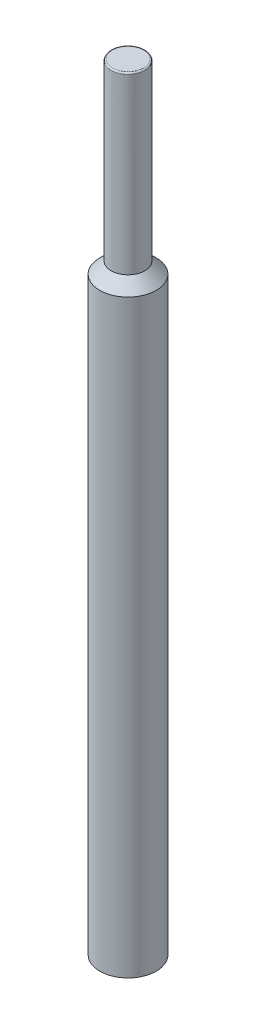
from build123d import *

# Parameters (mm, degrees)
FILLET1_R = 0.5


with BuildPart() as part:
    # Sketch2 → Revolve1 (revolve)
    with BuildSketch(Plane.XY, mode=Mode.PRIVATE) as revolve1_sk:
        Polygon((0, 0), (10, 0), (10, 209), (6, 213), (6, 275), (0, 275), align=None)
    revolve(revolve1_sk.sketch.rotate(Axis((0, 0, 0), (0, 1, 0)), 90), axis=Axis((0, 0, 0), (0, 1, 0)))

    # Fillet1
    fillet1_edges = [part.edges().sort_by_distance(p)[0] for p in [
        (0, 275, 6),
    ]]
    fillet(fillet1_edges, radius=FILLET1_R)


solid = part.part
